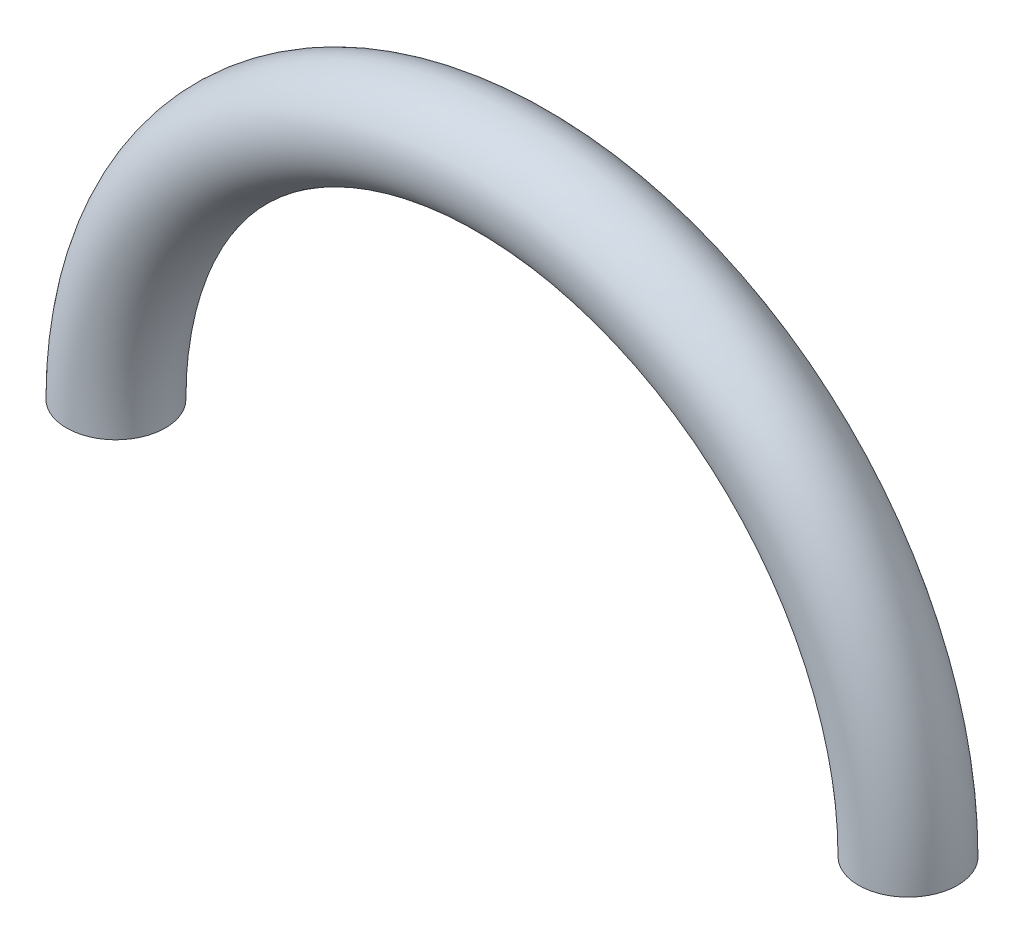
from build123d import *

# Parameters (mm, degrees)
SKETCH1_R  = 3.175
RING_ANGLE = 180


with BuildPart() as part:
    # Sketch1 → ring (revolve)
    with BuildSketch(Plane(origin=(0, 0, 0), x_dir=(1, 0, 0), z_dir=(0, 1, 0))):
        with Locations((25.4, 0)):
            Circle(SKETCH1_R)
    revolve(axis=Axis((0, 0, 6.35), (0, 0, 1)), revolution_arc=RING_ANGLE)


solid = part.part
